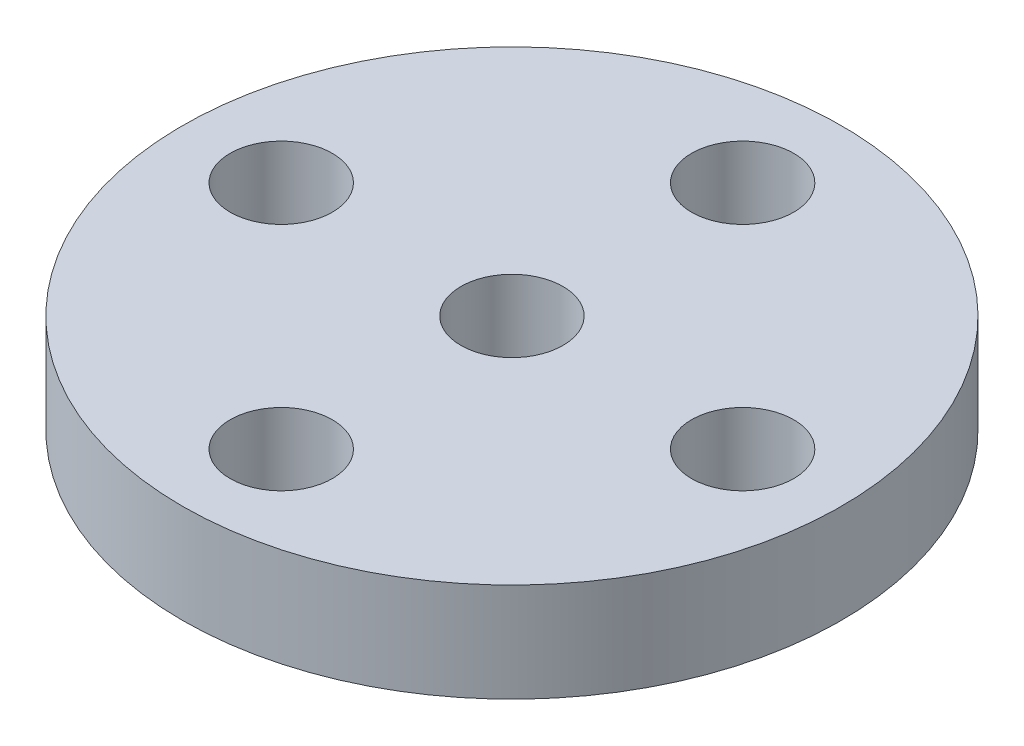
from build123d import *

# Parameters (mm, degrees)
SKETCH_1_R      = 4
SKETCH_1_R_2    = 1.55
EXTRUDE_1_DEPTH = 4
SKETCH_2_R      = 10
SKETCH_2_R_2    = 1.55
EXTRUDE_2_DEPTH = 3


with BuildPart() as part:
    # 草图1 → 凸台-拉伸1 (new body)
    with BuildSketch(Plane(origin=(0, 0, 0), x_dir=(1, 0, 0), z_dir=(0, 1, 0))):
        with Locations(Location((0, 0, 0), (0, 0, 270))):
            Circle(SKETCH_1_R)
        with Locations(Location((0, 0, 0), (0, 0, 270))):
            Circle(SKETCH_1_R_2, mode=Mode.SUBTRACT)
    extrude(amount=EXTRUDE_1_DEPTH)

    # 草图2 → 凸台-拉伸2 (add)
    with BuildSketch(Plane(origin=(0, 4, 0), x_dir=(1, 0, 0), z_dir=(0, 1, 0))):
        with Locations(Location((0, 0, 0), (0, 0, 270))):
            Circle(SKETCH_2_R)
        with Locations(Location((0, 0, 0), (0, 0, 270))):
            Circle(SKETCH_2_R_2, mode=Mode.SUBTRACT)
        with Locations(Location((0, 7, 0), (0, 0, 270))):
            Circle(SKETCH_2_R_2, mode=Mode.SUBTRACT)
        with Locations(Location((7, 0, 0), (0, 0, 270))):
            Circle(SKETCH_2_R_2, mode=Mode.SUBTRACT)
        with Locations(Location((0, -7, 0), (0, 0, 270))):
            Circle(SKETCH_2_R_2, mode=Mode.SUBTRACT)
        with Locations(Location((-7, 0, 0), (0, 0, 270))):
            Circle(SKETCH_2_R_2, mode=Mode.SUBTRACT)
    extrude(amount=EXTRUDE_2_DEPTH)


solid = part.part
